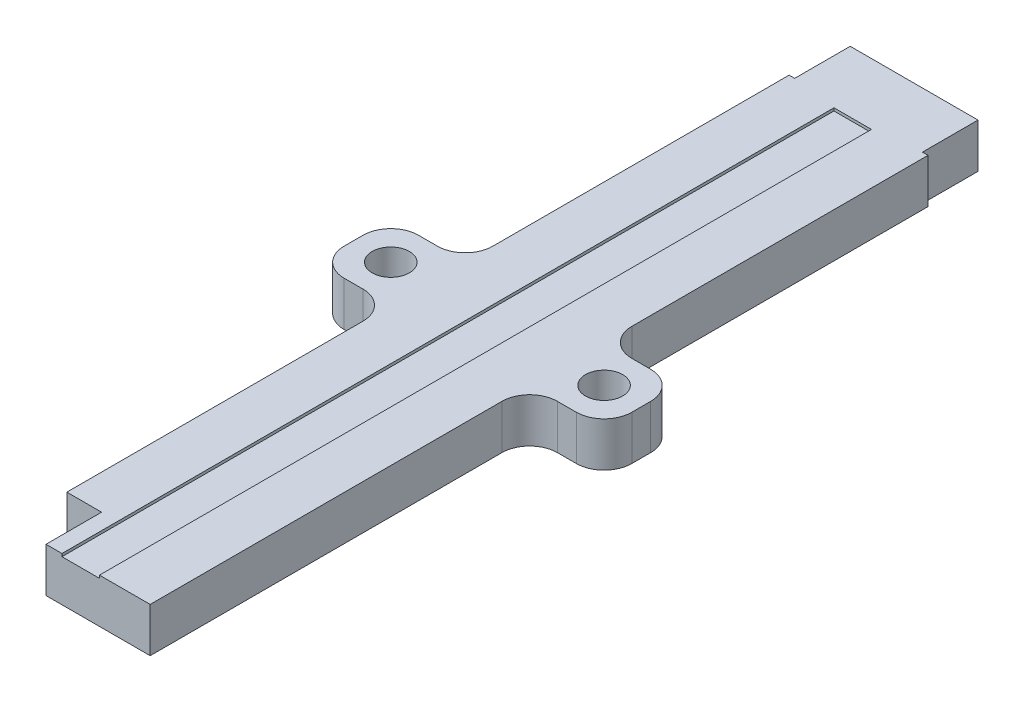
from build123d import *

# Parameters (mm, degrees)
SKETCH1_W               = 12.7
SKETCH1_H               = 4.064
BOSS_EXTRUDE1_DEPTH     = 228.6
SKETCH2_W               = 3.429
SKETCH2_H               = 217.3732
CUT_EXTRUDE1_DEPTH      = 0.254
SKETCH3_W               = 0.508
SKETCH3_H               = 5.08
CUT_EXTRUDE2_DEPTH      = 229.724285103
MIRROR2_COPY_1_SKETCH_W = 0.508
MIRROR2_COPY_1_SKETCH_H = 5.08
MIRROR2_COPY_1_DEPTH    = 229.724285103
SKETCH4_W               = 3.175
SKETCH4_H               = 3.175
CUT_EXTRUDE3_DEPTH      = 229.724285103
CUT_EXTRUDE5_DEPTH      = 229.724285103
SKETCH6_W               = 6.80212
SKETCH6_H               = 6.80212
SKETCH6_R               = 1.70053
BOSS_EXTRUDE2_DEPTH     = 4.064
FILLET1_R               = 2.54


with BuildPart() as part:
    # Sketch1 → Boss-Extrude1 (new body)
    with BuildSketch(Plane.XY):
        Rectangle(SKETCH1_W, SKETCH1_H)
    extrude(amount=BOSS_EXTRUDE1_DEPTH)

    # Sketch2 → Cut-Extrude1 (cut)
    with BuildSketch(Plane(origin=(0, 2.032, 0), x_dir=(1, 0, 0), z_dir=(0, 1, 0))):
        with Locations((0, -114.3)):
            Rectangle(SKETCH2_W, SKETCH2_H)
    extrude(amount=-CUT_EXTRUDE1_DEPTH, mode=Mode.SUBTRACT)

    # Sketch3 → Cut-Extrude2 (cut, through all)
    with BuildSketch(Plane(origin=(0, 2.032, 0), x_dir=(1, 0, 0), z_dir=(0, 1, 0))):
        with Locations((-6.096, -226.06)):
            Rectangle(SKETCH3_W, SKETCH3_H)
    cut_extrude2 = extrude(amount=-CUT_EXTRUDE2_DEPTH, mode=Mode.SUBTRACT)

    # Mirror1: Cut-Extrude2 across plane
    add(cut_extrude2.mirror(Plane(origin=(0, 0, 114.3), x_dir=(1, 0, 0), z_dir=(0, 0, -1))), mode=Mode.SUBTRACT)

    # Mirror2: Cut-Extrude2 across plane
    add(cut_extrude2.mirror(Plane(origin=(0, 0, 0), x_dir=(0, 0, 1), z_dir=(1, 0, 0))), mode=Mode.SUBTRACT)

    # Mirror2 copy 1 sketch → Mirror2 copy 1 (cut, through all)
    with BuildSketch(Plane(origin=(0, 2.032, 228.6), x_dir=(-1, 0, 0), z_dir=(0, 1, 0))):
        with Locations((-6.096, -226.06)):
            Rectangle(MIRROR2_COPY_1_SKETCH_W, MIRROR2_COPY_1_SKETCH_H)
    extrude(amount=-MIRROR2_COPY_1_DEPTH, mode=Mode.SUBTRACT)

    # Sketch4 → Cut-Extrude3 (cut, through all)
    with BuildSketch(Plane(origin=(0, 2.032, 0), x_dir=(1, 0, 0), z_dir=(0, 1, 0))):
        with Locations((-4.2545, -227.0125)):
            Rectangle(SKETCH4_W, SKETCH4_H)
    extrude(amount=-CUT_EXTRUDE3_DEPTH, mode=Mode.SUBTRACT)

    # Sketch5 → Cut-Extrude5 (cut, through all)
    with BuildSketch(Plane(origin=(0, 2.032, 0), x_dir=(1, 0, 0), z_dir=(0, 1, 0))):
        Polygon((-6.35, -71.12), (-6.35, -152.4), (-6.35, -228.6), (6.35, -228.6), (6.35, -155.575), (6.35, -152.4), (6.35, -76.2), (-3.175, -76.2), (-3.175, -71.12), align=None)
    extrude(amount=-CUT_EXTRUDE5_DEPTH, mode=Mode.SUBTRACT)

    # Sketch6 → Boss-Extrude2 (add, through all)
    # profile 1 of 2: a face of its own
    with BuildSketch(Plane(origin=(0, 2.032, 0), x_dir=(1, 0, 0), z_dir=(0, 1, 0))):
        with Locations((9.75106, -38.1)):
            Rectangle(SKETCH6_W, SKETCH6_H)
        with Locations(Location((9.75106, -38.1, 0), (0, 0, 270))):
            Circle(SKETCH6_R, mode=Mode.SUBTRACT)
    # profile 2 of 2: a face of its own
    with BuildSketch(Plane(origin=(0, 2.032, 0), x_dir=(1, 0, 0), z_dir=(0, 1, 0))):
        with Locations((-9.75106, -38.1)):
            Rectangle(SKETCH6_W, SKETCH6_H)
        with Locations(Location((-9.75106, -38.1, 0), (0, 0, 90))):
            Circle(SKETCH6_R, mode=Mode.SUBTRACT)
    extrude(amount=-BOSS_EXTRUDE2_DEPTH)

    # Fillet1
    fillet1_edges = [part.edges().sort_by_distance(p)[0] for p in [
        (6.35, 0, 41.50106),
        (13.15212, 0, 41.50106),
        (13.15212, 0, 34.69894),
        (6.35, 0, 34.69894),
        (-6.35, 0, 34.69894),
        (-13.15212, 0, 34.69894),
        (-13.15212, 0, 41.50106),
        (-6.35, 0, 41.50106),
    ]]
    fillet(fillet1_edges, radius=FILLET1_R)


solid = part.part
